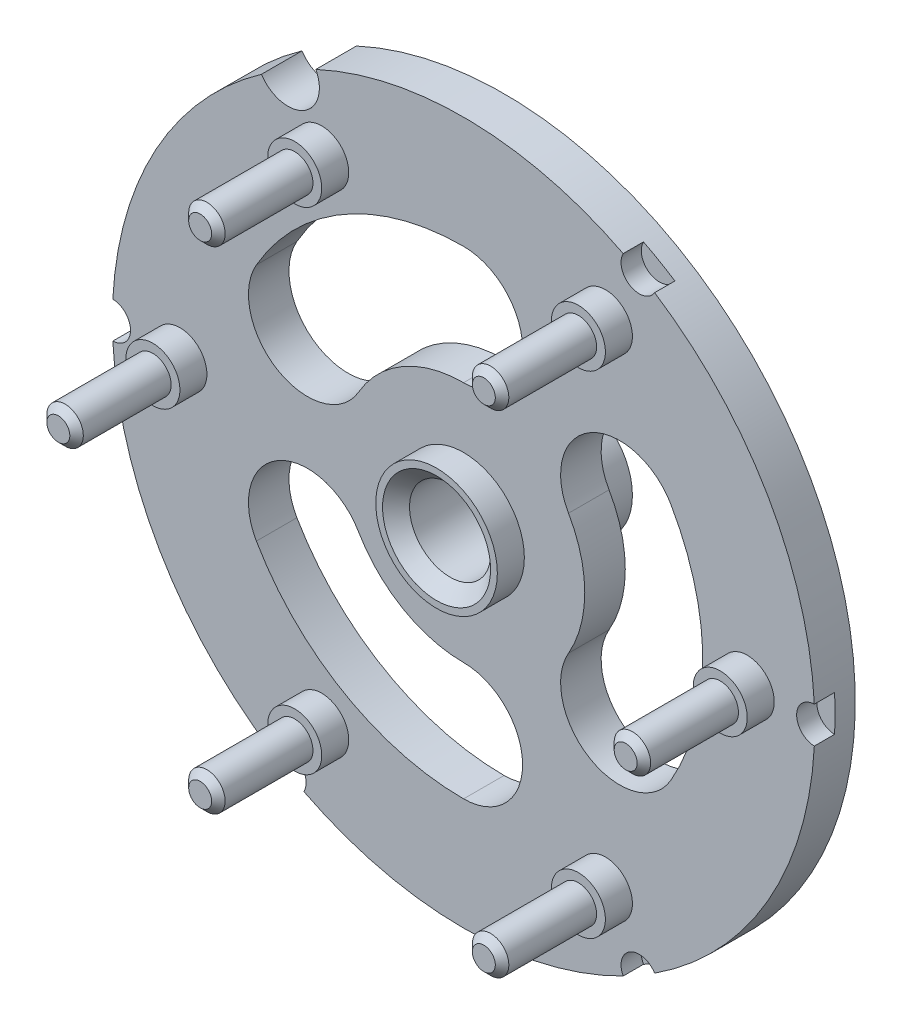
from build123d import *

# Parameters (mm, degrees)
SKETCH_1_R               = 26
EXTRUDE_1_DEPTH          = 3
SKETCH_2_R               = 1.35
EXTRUDE_2_DEPTH          = 9
SKETCH_4_R               = 2
EXTRUDE_4_DEPTH          = 2
SKETCH_5_R               = 3
CUT_EXTRUDE_1_DEPTH      = 38.854986461
SKETCH_7_R               = 4.5
SKETCH_7_R_2             = 3
EXTRUDE_1_2_DEPTH        = 8
EXTRUDE_START            = 2
SKETCH_8_R               = 4.5
SKETCH_8_R_2             = 3
EXTRUDE_2_2_DEPTH        = 2
CUT_EXTRUDE_2_REACH      = 39.855
SKETCH_9_R               = 2.326383569
SKETCH_10_R              = 1.343821969
CUT_EXTRUDE_3_DEPTH      = 1.5
CUT_EXTRUDE_4_REACH      = 40.678
CHAMFER_1_SIZE           = 1
CHAMFER_3_SIZE           = 0.5
PATTERN_CIRCULAR_1_COUNT = 3


with BuildPart() as part:
    # 草图1 → Extrude 1 (new body)
    with BuildSketch(Plane.XY):
        Circle(SKETCH_1_R)
    extrude(amount=-EXTRUDE_1_DEPTH)

    # 草图2 → Extrude 2 (add)
    with BuildSketch(Plane.XY):
        with Locations((-21, 0)):
            Circle(SKETCH_2_R)
        with Locations((-10.5, 18.186533479)):
            Circle(SKETCH_2_R)
        with Locations((10.5, 18.186533479)):
            Circle(SKETCH_2_R)
        with Locations((21, 0)):
            Circle(SKETCH_2_R)
        with Locations((10.5, -18.186533479)):
            Circle(SKETCH_2_R)
        with Locations((-10.5, -18.186533479)):
            Circle(SKETCH_2_R)
    extrude(amount=EXTRUDE_2_DEPTH)

    # 草图4 → 凸台-拉伸4 (add)
    with BuildSketch(Plane.XY):
        with Locations((-10.5, 18.186533479)):
            Circle(SKETCH_4_R)
        with Locations((10.5, 18.186533479)):
            Circle(SKETCH_4_R)
        with Locations((21, 0)):
            Circle(SKETCH_4_R)
        with Locations((10.5, -18.186533479)):
            Circle(SKETCH_4_R)
        with Locations((-10.5, -18.186533479)):
            Circle(SKETCH_4_R)
        with Locations((-21, 0)):
            Circle(SKETCH_4_R)
    extrude(amount=EXTRUDE_4_DEPTH)

    # 草图5 → 切除-拉伸1 (cut, through all)
    with BuildSketch(Plane.XY):
        Circle(SKETCH_5_R)
    extrude(amount=-CUT_EXTRUDE_1_DEPTH, mode=Mode.SUBTRACT)

    # 草图7 → Extrude 1 2 (add)
    with BuildSketch(Plane.XY):
        Circle(SKETCH_7_R)
        Circle(SKETCH_7_R_2, mode=Mode.SUBTRACT)
    extrude(amount=-EXTRUDE_1_2_DEPTH)

    # 草图8 → Extrude 2 2 (add)
    with BuildSketch(Plane.XY.offset(EXTRUDE_START)):
        Circle(SKETCH_8_R)
        Circle(SKETCH_8_R_2, mode=Mode.SUBTRACT)
    extrude(amount=-EXTRUDE_2_2_DEPTH)

    # 草图9 → 切除-拉伸2 (cut, up to next)
    with BuildSketch(Plane.XY, mode=Mode.PRIVATE) as cut_extrude_2_sk1:
        with Locations((-13, 22.516660498)):
            Circle(SKETCH_9_R)
    cut_extrude_2_tool1 = extrude(cut_extrude_2_sk1.sketch, amount=-CUT_EXTRUDE_2_REACH, mode=Mode.PRIVATE) & part.part
    add(cut_extrude_2_tool1.solids().sort_by_distance((-13, 22.51666, 0))[0], mode=Mode.SUBTRACT)

    # 草图10 → 切除-拉伸3 (cut)
    with BuildSketch(Plane.XY):
        with Locations((-13, 22.516660498)):
            Circle(SKETCH_10_R)
        with Locations((13, 22.516660498)):
            Circle(SKETCH_10_R)
        with Locations((26, 0)):
            Circle(SKETCH_10_R)
        with Locations((13, -22.516660498)):
            Circle(SKETCH_10_R)
        with Locations((-13, -22.516660498)):
            Circle(SKETCH_10_R)
        with Locations((-26, 0)):
            Circle(SKETCH_10_R)
    extrude(amount=-CUT_EXTRUDE_3_DEPTH, mode=Mode.SUBTRACT)

    # 草图11 → 切除-拉伸4 (cut, up to next)
    with BuildSketch(Plane(origin=(0, 0, -3), x_dir=(-1, 0, 0), z_dir=(0, 0, -1)), mode=Mode.PRIVATE) as cut_extrude_4_sk1:
        with BuildLine():
            ThreePointArc((15.338641918, 8.855769041), (8.855769041, 15.338641918), (0, 17.711538081))
            ThreePointArc((0, 17.711538081), (-4.370103516, 13.341434566), (0, 8.97133105))
            ThreePointArc((0, 8.97133105), (4.485665525, 7.769400595), (7.769400595, 4.485665525))
            ThreePointArc((7.769400595, 4.485665525), (13.739073015, 2.886096621), (15.338641918, 8.855769041))
        make_face()
    cut_extrude_4_tool1 = extrude(cut_extrude_4_sk1.sketch, amount=-CUT_EXTRUDE_4_REACH, mode=Mode.PRIVATE) & part.part
    cut_extrude_4 = cut_extrude_4_tool1.solids().sort_by_distance((-6.174677, 10.694854, -3))[0]
    add(cut_extrude_4, mode=Mode.SUBTRACT)

    # 倒角1
    chamfer_1_edges = [part.edges().sort_by_distance(p)[0] for p in [
        (-3, 0, 2),
    ]]
    chamfer(chamfer_1_edges, length=CHAMFER_1_SIZE)

    # 倒角3
    chamfer_3_edges = [part.edges().sort_by_distance(p)[0] for p in [
        (-11.85, -18.186533479, 9),
        (9.15, -18.186533479, 9),
        (19.65, 0, 9),
        (9.15, 18.186533479, 9),
        (-11.85, 18.186533479, 9),
        (-22.35, 0, 9),
    ]]
    chamfer(chamfer_3_edges, length=CHAMFER_3_SIZE)

    # 阵列(圆周)1: 切除-拉伸4 ×3 about axis
    pattern_circular_1_axis = Axis((0, 0, -3), (0, 0, 1))
    for i in range(1, PATTERN_CIRCULAR_1_COUNT):
        add(cut_extrude_4.rotate(pattern_circular_1_axis, i * 360 / PATTERN_CIRCULAR_1_COUNT), mode=Mode.SUBTRACT)


solid = part.part
